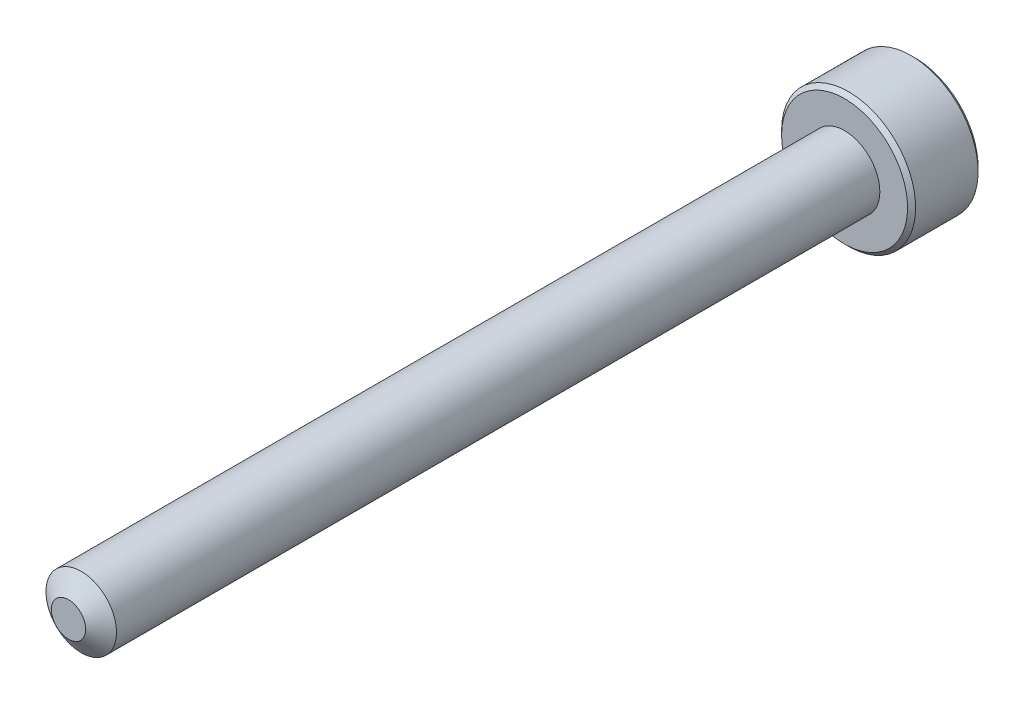
from build123d import *

# Parameters (mm, degrees)
SKETCH1_R          = 1
EXTRUDE1_DEPTH     = 22
SKETCH6_R          = 1.9
EXTRUDE2_DEPTH     = 2
CUT_EXTRUDE1_DEPTH = 1.125
CHAMFER1_SIZE      = 0.114


with BuildPart() as part:
    # Sketch1 → Extrude1 (new body)
    with BuildSketch(Plane.XY):
        Circle(SKETCH1_R)
    extrude(amount=-EXTRUDE1_DEPTH)

    # Sketch4 → Cut-Revolve1 (revolve, cut)
    with BuildSketch(Plane(origin=(0, 0, 0), x_dir=(0, 0, -1), z_dir=(1, 0, 0)), mode=Mode.PRIVATE) as cut_revolve1_sk:
        Polygon((0.35977197, 1), (0, 0.486192379), (0, 1), align=None)
    revolve(cut_revolve1_sk.sketch.rotate(Axis((0, 0, 0), (0, 0, -1)), 90), axis=Axis((0, 0, 0), (0, 0, -1)), mode=Mode.SUBTRACT)

    # Sketch6 → Extrude2 (add)
    with BuildSketch(Plane(origin=(0, 0, -22), x_dir=(-1, 0, 0), z_dir=(0, 0, -1))):
        Circle(SKETCH6_R)
    extrude(amount=EXTRUDE2_DEPTH)

    # Sketch7 → Cut-Extrude1 (cut)
    with BuildSketch(Plane(origin=(0, 0, -24), x_dir=(-1, 0, 0), z_dir=(0, 0, -1))):
        Polygon((0, 0.866025404), (-0.75, 0.433012702), (-0.75, -0.433012702), (0, -0.866025404), (0.75, -0.433012702), (0.75, 0.433012702), align=None)
    extrude(amount=-CUT_EXTRUDE1_DEPTH, mode=Mode.SUBTRACT)

    # Cut-Extrude2 cone 1 section (through the dimple's axis) → Cut-Extrude2 (revolve, cut)
    with BuildSketch(Plane(origin=(0, 0, -24), x_dir=(0, 1, 0), z_dir=(1, 0, 0))):
        Polygon((0, 0), (0.866025404, 0), (0, 0.866025404), align=None)
    revolve(axis=Axis((0, 0, -24), (0, 0, 1)), mode=Mode.SUBTRACT)

    # Chamfer1
    chamfer1_edges = [part.edges().sort_by_distance(p)[0] for p in [
        (1.9, 0, -22),
        (1.9, 0, -24),
    ]]
    chamfer(chamfer1_edges, length=CHAMFER1_SIZE)

    # Sketch10 → Revolve1 (revolve)
    with BuildSketch(Plane(origin=(0, 0, 0), x_dir=(0, 0, -1), z_dir=(1, 0, 0))):
        Polygon((22, 1), (22, 0), (21.485786438, 0), (21.9, 1), align=None)
    revolve(axis=Axis((0, 0, -22), (0, 0, 1)))


solid = part.part
